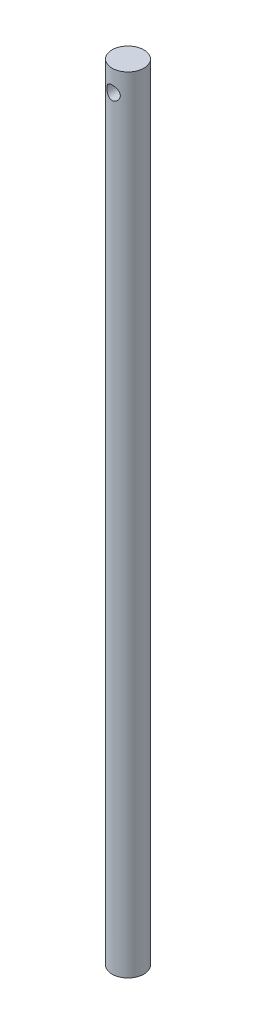
from build123d import *

# Parameters (mm, degrees)
SKETCH1_R               = 7.5
BOSS_EXTRUDE1_DEPTH     = 350
SKETCH3_R               = 7.5
BOSS_EXTRUDE2_DEPTH     = 20
CUT_EXTRUDE1_DEPTH      = 371.151995807
CUT_EXTRUDE1_DEPTH_BACK = 371.151995807
SKETCH4_R               = 3.175


with BuildPart() as part:
    # Sketch1 → Boss-Extrude1 (new body)
    with BuildSketch(Plane(origin=(0, 0, 0), x_dir=(1, 0, 0), z_dir=(0, 1, 0))):
        with Locations(Location((0, 0, 0), (0, 0, 270))):
            Circle(SKETCH1_R)
    extrude(amount=BOSS_EXTRUDE1_DEPTH)

    # Sketch3 → Boss-Extrude2 (add)
    with BuildSketch(Plane(origin=(0, 350, 0), x_dir=(1, 0, 0), z_dir=(0, 1, 0))):
        with Locations(Location((0, 0, 0), (0, 0, 270))):
            Circle(SKETCH3_R)
    extrude(amount=BOSS_EXTRUDE2_DEPTH)

    # Sketch4 → Cut-Extrude1 (cut, two sides: drawn at the far end of the back side and taken through both)
    with BuildSketch(Plane.XY.offset(-CUT_EXTRUDE1_DEPTH_BACK)):
        with Locations(Location((0, 360, 0), (0, 0, 90.000000001))):
            Circle(SKETCH4_R)
    extrude(amount=CUT_EXTRUDE1_DEPTH + CUT_EXTRUDE1_DEPTH_BACK, mode=Mode.SUBTRACT)


solid = part.part
